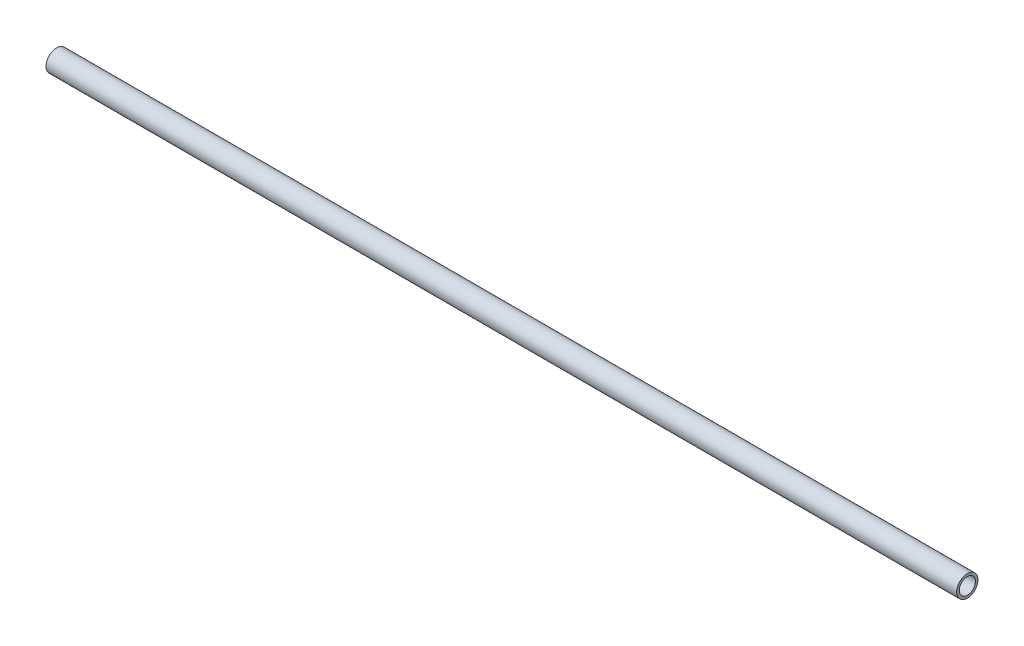
from build123d import *

# Parameters (mm, degrees)
SKETCH1_R           = 1.0541
SKETCH1_R_2         = 0.8001
BOSS_EXTRUDE1_DEPTH = 90
SKETCH3_R           = 0.396875
CUT_EXTRUDE2_DEPTH  = 10


with BuildPart() as part:
    # Sketch1 → Boss-Extrude1 (new body)
    with BuildSketch(Plane(origin=(0, 0, 0), x_dir=(0, 0, -1), z_dir=(1, 0, 0))):
        Circle(SKETCH1_R)
        Circle(SKETCH1_R_2, mode=Mode.SUBTRACT)
    extrude(amount=BOSS_EXTRUDE1_DEPTH)

    # Sketch3 → Cut-Extrude2 (cut)
    with BuildSketch(Plane.XY):
        with Locations((0.798611036, 0)):
            Circle(SKETCH3_R)
    extrude(amount=-CUT_EXTRUDE2_DEPTH, mode=Mode.SUBTRACT)


solid = part.part
